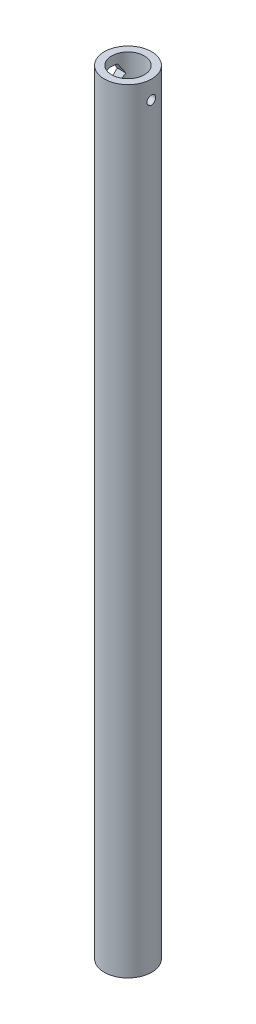
from build123d import *

# Parameters (mm, degrees)
SKETCH1_R           = 8.255
SKETCH1_R_2         = 5.715
BOSS_EXTRUDE1_DEPTH = 269.875
CUT_EXTRUDE1_DEPTH  = 271.127387865
SKETCH3_R           = 1.524
CUT_EXTRUDE2_DEPTH  = 271.127387865
SKETCH4_R           = 5.715
SKETCH4_R_2         = 5.08
BOSS_EXTRUDE2_DEPTH = 3.81


with BuildPart() as part:
    # Sketch1 → Boss-Extrude1 (new body)
    with BuildSketch(Plane(origin=(0, 0, 0), x_dir=(1, 0, 0), z_dir=(0, 1, 0))):
        with Locations(Location((0, 0, 0), (0, 0, 270))):
            Circle(SKETCH1_R)
        with Locations(Location((0, 0, 0), (0, 0, 270))):
            Circle(SKETCH1_R_2, mode=Mode.SUBTRACT)
    extrude(amount=BOSS_EXTRUDE1_DEPTH)

    # Sketch2 → Cut-Extrude1 (cut, through all)
    with BuildSketch(Plane(origin=(0, 0, 0), x_dir=(0, 0, -1), z_dir=(1, 0, 0))):
        Polygon((1.833087105, 260.35), (3.666174209, 263.525), (1.833087105, 266.7), (-1.833087105, 266.7), (-3.666174209, 263.525), (-1.833087105, 260.35), align=None)
    extrude(amount=-CUT_EXTRUDE1_DEPTH, mode=Mode.SUBTRACT)

    # Sketch3 → Cut-Extrude2 (cut, through all)
    with BuildSketch(Plane(origin=(0, 0, 0), x_dir=(0, 0, -1), z_dir=(1, 0, 0))):
        with Locations(Location((0, 263.525, 0), (0, 0, 180))):
            Circle(SKETCH3_R)
    extrude(amount=CUT_EXTRUDE2_DEPTH, mode=Mode.SUBTRACT)

    # Sketch4 → Boss-Extrude2 (add)
    with BuildSketch(Plane.XZ):
        with Locations(Location((0, 0, 0), (0, 0, 270))):
            Circle(SKETCH4_R)
        with Locations(Location((0, 0, 0), (0, 0, 270))):
            Circle(SKETCH4_R_2, mode=Mode.SUBTRACT)
    extrude(amount=-BOSS_EXTRUDE2_DEPTH)


solid = part.part
